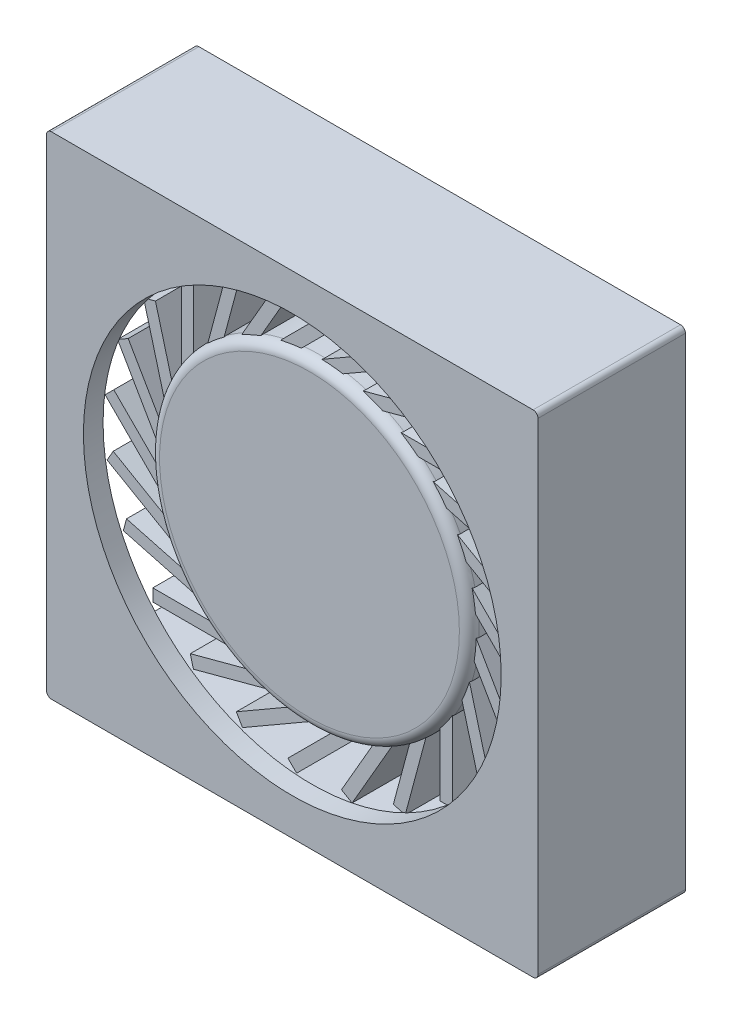
from build123d import *

# Parameters (mm, degrees)
SKETCH_1_W          = 20
SKETCH_1_H          = 20
EXTRUDE_1_DEPTH     = 6
SHELL_1_T           = -0.8
SKETCH_2_R          = 8.5
CUT_EXTRUDE_1_DEPTH = 5
SKETCH_3_R          = 6.5
EXTRUDE_2_DEPTH     = 4.5
FILLET_1_R          = 0.4
SKETCH_4_W          = 0.5
SKETCH_4_H          = 3.787032243
SKETCH_4_W_2        = 3.787032243
SKETCH_4_H_2        = 0.5
EXTRUDE_4_DEPTH     = 4.2
FILLET_2_R          = 0.2


with BuildPart() as part:
    # 草图1 → 凸台-拉伸1 (new body)
    with BuildSketch(Plane.XY):
        with Locations((10, -10)):
            Rectangle(SKETCH_1_W, SKETCH_1_H)
    extrude(amount=EXTRUDE_1_DEPTH)

    # 抽壳1
    shell_1_openings = [part.faces().sort_by_distance(p)[0] for p in [
        (0, -10, 3),
    ]]
    offset(amount=SHELL_1_T, openings=shell_1_openings, kind=Kind.INTERSECTION)

    # 草图2 → 切除-拉伸1 (cut)
    with BuildSketch(Plane.XY.offset(6)):
        with Locations((10, -10)):
            Circle(SKETCH_2_R)
    extrude(amount=-CUT_EXTRUDE_1_DEPTH, mode=Mode.SUBTRACT)

    # 草图3 → 凸台-拉伸2 (add)
    with BuildSketch(Plane.XY.offset(0.8)):
        with Locations((10, -10)):
            Circle(SKETCH_3_R)
    extrude(amount=EXTRUDE_2_DEPTH)

    # 圆角1
    fillet_1_edges = [part.edges().sort_by_distance(p)[0] for p in [
        (3.5, -10, 5.3),
    ]]
    fillet(fillet_1_edges, radius=FILLET_1_R)

    # 草图4 → 凸台-拉伸4 (add)
    with BuildSketch(Plane.XY.offset(0.8)):
        Polygon((3.782609294, -10.253934343), (1.889093173, -6.974268215), (2.322105875, -6.724268215), (4.215621996, -10.003934343), align=None)
        Polygon((4.411701614, -8.506693092), (3.928738701, -8.636102614), (2.948582632, -4.978110366), (3.431545546, -4.848700843), align=None)
        with Locations((4.738614532, -5.217702118)):
            Rectangle(SKETCH_4_W, SKETCH_4_H)
        Polygon((5.907045088, -5.912609089), (5.424082175, -5.783199567), (6.404238244, -2.125207318), (6.887201157, -2.254616841), align=None)
        Polygon((7.104403757, -4.992548875), (6.671391056, -4.742548875), (8.564907177, -1.462882748), (8.997919879, -1.712882748), align=None)
        Polygon((8.499092525, -4.41373818), (8.145539135, -4.060184789), (10.823375314, -1.38234861), (11.176928705, -1.735902001), align=None)
        Polygon((9.996065657, -4.215621996), (9.746065657, -3.782609294), (13.025731785, -1.889093173), (13.275731785, -2.322105875), align=None)
        Polygon((11.493306908, -4.411701614), (11.363897386, -3.928738701), (15.021889634, -2.948582632), (15.151299157, -3.431545546), align=None)
        with Locations((14.782297882, -4.738614532)):
            Rectangle(SKETCH_4_W_2, SKETCH_4_H_2)
        Polygon((14.087390911, -5.907045088), (14.216800433, -5.424082175), (17.874792682, -6.404238244), (17.745383159, -6.887201157), align=None)
        Polygon((15.007451125, -7.104403757), (15.257451125, -6.671391056), (18.537117252, -8.564907177), (18.287117252, -8.997919879), align=None)
        Polygon((15.58626182, -8.499092525), (15.939815211, -8.145539135), (18.61765139, -10.823375314), (18.264097999, -11.176928705), align=None)
        Polygon((15.784378004, -9.996065657), (16.217390706, -9.746065657), (18.110906827, -13.025731785), (17.677894125, -13.275731785), align=None)
        Polygon((15.588298386, -11.493306908), (16.071261299, -11.363897386), (17.051417368, -15.021889634), (16.568454454, -15.151299157), align=None)
        with Locations((15.261385468, -14.782297882)):
            Rectangle(SKETCH_4_W, SKETCH_4_H)
        Polygon((14.092954912, -14.087390911), (14.575917825, -14.216800433), (13.595761756, -17.874792682), (13.112798843, -17.745383159), align=None)
        Polygon((12.895596243, -15.007451125), (13.328608944, -15.257451125), (11.435092823, -18.537117252), (11.002080121, -18.287117252), align=None)
        Polygon((11.500907475, -15.58626182), (11.854460865, -15.939815211), (9.176624686, -18.61765139), (8.823071295, -18.264097999), align=None)
        Polygon((10.003934343, -15.784378004), (10.253934343, -16.217390706), (6.974268215, -18.110906827), (6.724268215, -17.677894125), align=None)
        Polygon((8.506693092, -15.588298386), (8.636102614, -16.071261299), (4.978110366, -17.051417368), (4.848700843, -16.568454454), align=None)
        with Locations((5.217702118, -15.261385468)):
            Rectangle(SKETCH_4_W_2, SKETCH_4_H_2)
        Polygon((5.912609089, -14.092954912), (5.783199567, -14.575917825), (2.125207318, -13.595761756), (2.254616841, -13.112798843), align=None)
        Polygon((4.992548875, -12.895596243), (4.742548875, -13.328608944), (1.462882748, -11.435092823), (1.712882748, -11.002080121), align=None)
        Polygon((4.41373818, -11.500907475), (4.060184789, -11.854460865), (1.38234861, -9.176624686), (1.735902001, -8.823071295), align=None)
    extrude(amount=EXTRUDE_4_DEPTH)

    # 圆角2
    fillet_2_edges = [part.edges().sort_by_distance(p)[0] for p in [
        (0, 0, 3),
        (20, 0, 3),
        (20, -20, 3),
        (0, -20, 3),
    ]]
    fillet(fillet_2_edges, radius=FILLET_2_R)


solid = part.part
